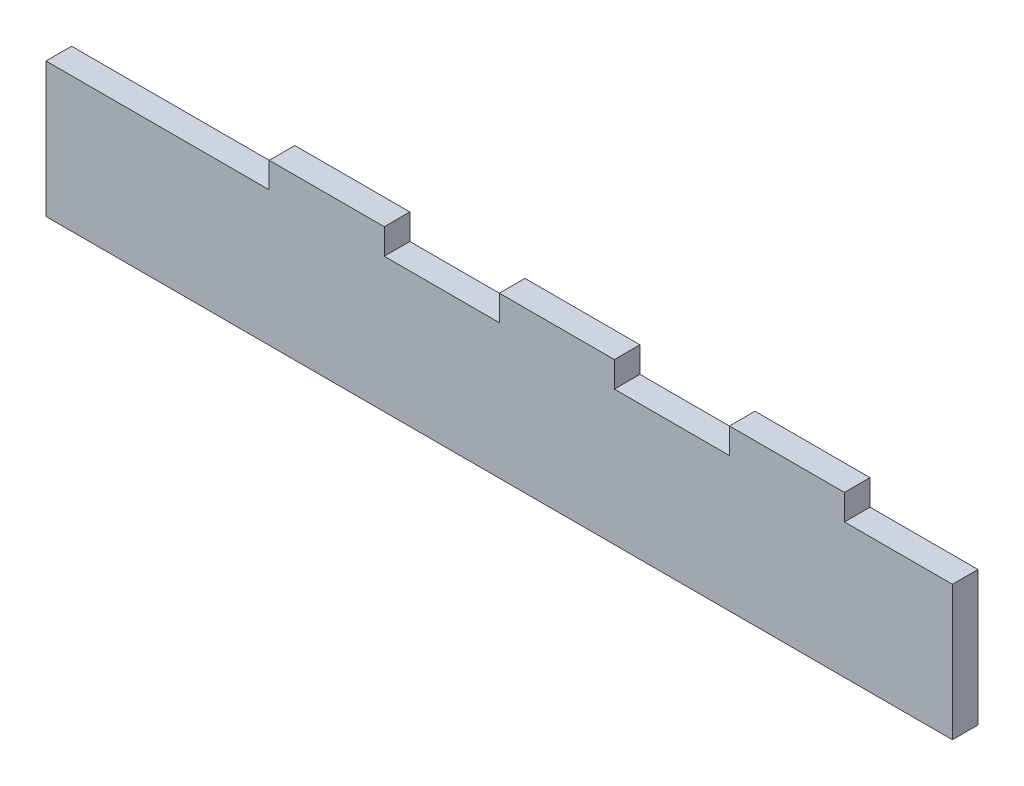
from build123d import *

# Parameters (mm, degrees)
SKETCH1_W           = 170.942
SKETCH1_H           = 30.226
BOSS_EXTRUDE1_DEPTH = 4.826
SKETCH2_W           = 42.09509181
SKETCH2_H           = 4.826
SKETCH2_W_2         = 21.697199751
SKETCH2_W_3         = 20.39789206
CUT_EXTRUDE1_DEPTH  = 174.660786351


with BuildPart() as part:
    # Sketch1 → Boss-Extrude1 (new body)
    with BuildSketch(Plane.XY):
        with Locations((85.471, 15.113)):
            Rectangle(SKETCH1_W, SKETCH1_H)
    extrude(amount=BOSS_EXTRUDE1_DEPTH)

    # Sketch2 → Cut-Extrude1 (cut, through all)
    with BuildSketch(Plane(origin=(0, 0, 0), x_dir=(-1, 0, 0), z_dir=(0, 0, -1))):
        with Locations((-21.047545905, 27.813)):
            Rectangle(SKETCH2_W, SKETCH2_H)
        with Locations((-74.640891438, 27.813)):
            Rectangle(SKETCH2_W_2, SKETCH2_H)
        with Locations((-118.035290941, 27.813)):
            Rectangle(SKETCH2_W_2, SKETCH2_H)
        with Locations((-160.780036597, 27.813)):
            Rectangle(SKETCH2_W_3, SKETCH2_H)
    extrude(amount=-CUT_EXTRUDE1_DEPTH, mode=Mode.SUBTRACT)


solid = part.part
